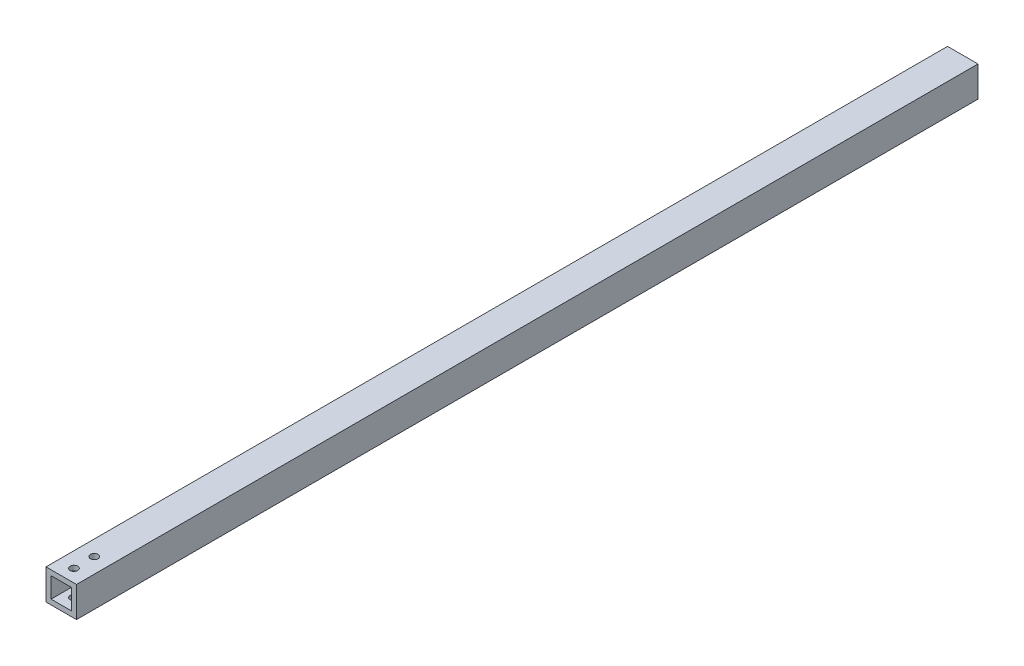
from build123d import *

# Parameters (mm, degrees)
SKETCH_2_W          = 12
SKETCH_2_H          = 12
SKETCH_2_W_2        = 8
SKETCH_2_H_2        = 8
EXTRUDE_1_DEPTH     = 355
SKETCH_5_R          = 1.5
CUT_EXTRUDE_2_DEPTH = 356.253430666


with BuildPart() as part:
    # 草图2 → 凸台-拉伸1 (new body)
    with BuildSketch(Plane.XY):
        Rectangle(SKETCH_2_W, SKETCH_2_H)
        Rectangle(SKETCH_2_W_2, SKETCH_2_H_2, mode=Mode.SUBTRACT)
    extrude(amount=EXTRUDE_1_DEPTH)

    # 草图5 → 切除-拉伸2 (cut, through all)
    with BuildSketch(Plane(origin=(0, 6, 0), x_dir=(1, 0, 0), z_dir=(0, 1, 0))):
        with Locations(Location((0, -350, 0), (0, 0, 180))):
            Circle(SKETCH_5_R)
        with Locations(Location((0, -342, 0), (0, 0, 180))):
            Circle(SKETCH_5_R)
    extrude(amount=-CUT_EXTRUDE_2_DEPTH, mode=Mode.SUBTRACT)


solid = part.part
